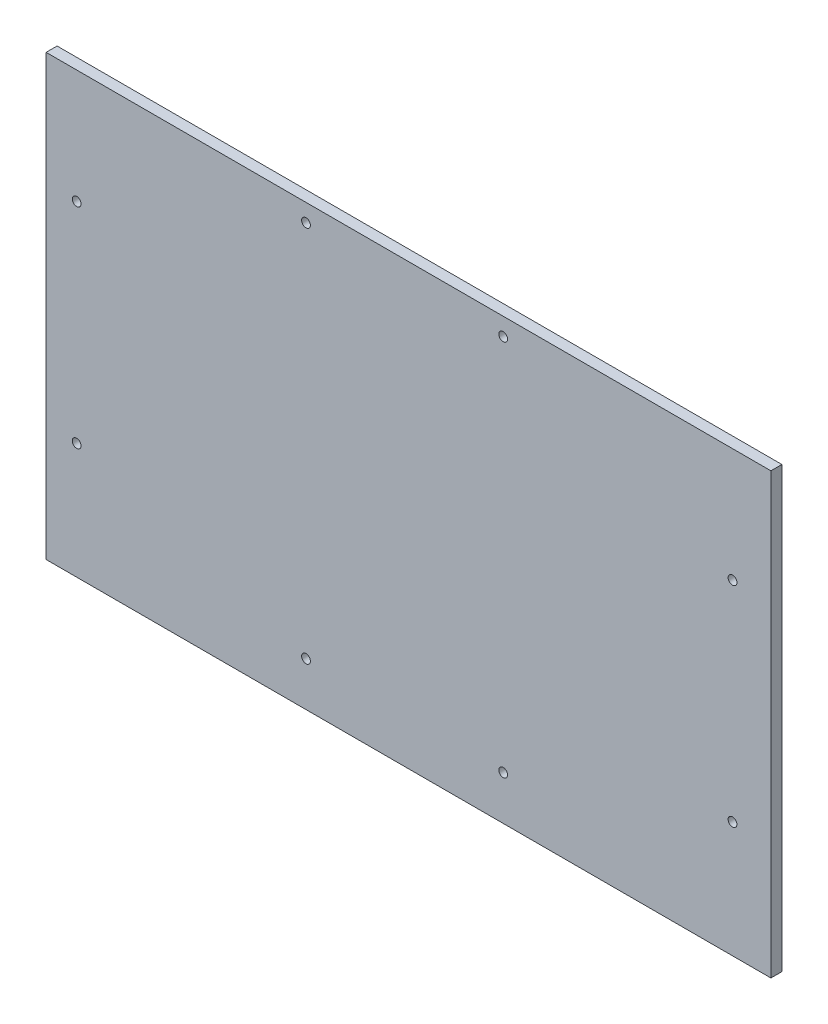
from build123d import *

# Parameters (mm, degrees)
SKETCH1_W               = 330
SKETCH1_H               = 200
BOSS_EXTRUDE1_DEPTH     = 5
CUT_EXTRUDE1_DEPTH      = 110
CUT_EXTRUDE1_DEPTH_BACK = 10
SKETCH2_R               = 2


with BuildPart() as part:
    # Sketch1 → Boss-Extrude1 (new body)
    with BuildSketch(Plane.XY):
        with Locations((175.898578828, -272.636032505)):
            Rectangle(SKETCH1_W, SKETCH1_H)
    extrude(amount=BOSS_EXTRUDE1_DEPTH)

    # Sketch2 → Cut-Extrude1 (cut, two sides: drawn at the far end of the back side and taken through both)
    with BuildSketch(Plane.XY.offset(5).offset(-CUT_EXTRUDE1_DEPTH_BACK)):
        with Locations(Location((24.801887312, -224.471344643, 0), (0, 0, 180))):
            Circle(SKETCH2_R)
        with Locations(Location((24.801887312, -319.841869215, 0), (0, 0, 180))):
            Circle(SKETCH2_R)
        with Locations(Location((129.231353532, -180.68646001, 0), (0, 0, 180))):
            Circle(SKETCH2_R)
        with Locations(Location((129.231353532, -352.554714055, 0), (0, 0, 180))):
            Circle(SKETCH2_R)
        with Locations(Location((218.990638171, -352.554714055, 0), (0, 0, 180))):
            Circle(SKETCH2_R)
        with Locations(Location((323.420104391, -319.841869215, 0), (0, 0, 180))):
            Circle(SKETCH2_R)
        with Locations(Location((323.420104391, -224.471344643, 0), (0, 0, 180))):
            Circle(SKETCH2_R)
        with Locations(Location((218.990638171, -180.68646001, 0), (0, 0, 180))):
            Circle(SKETCH2_R)
    extrude(amount=CUT_EXTRUDE1_DEPTH + CUT_EXTRUDE1_DEPTH_BACK, mode=Mode.SUBTRACT)


solid = part.part
